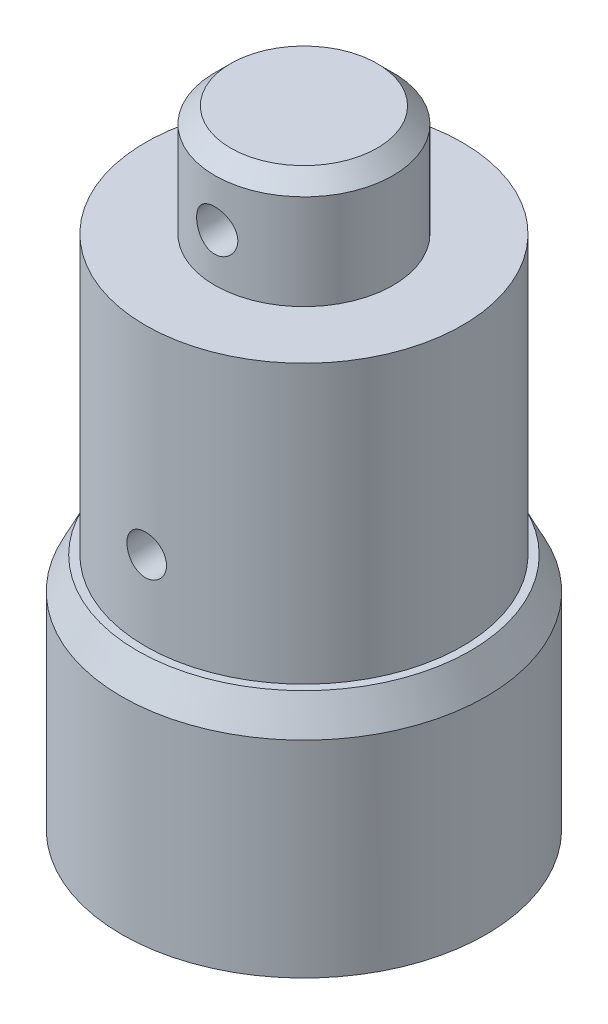
from build123d import *
from OCP.BRepFilletAPI import BRepFilletAPI_MakeChamfer

# Parameters (mm, degrees)
SKETCH1_R           = 12.7
BOSS_EXTRUDE1_DEPTH = 31.1658
SKETCH2_R           = 12.7
SKETCH2_R_2         = 3.2385
CUT_EXTRUDE1_DEPTH  = 12.7
CUT_EXTRUDE2_START  = -8.89
SKETCH3_R           = 12.7
SKETCH3_R_2         = 7.14375
CUT_EXTRUDE2_DEPTH  = 8.89
CHAMFER1_SIZE       = 1.27
SKETCH4_R           = 12.7
SKETCH4_R_2         = 7.747
BOSS_EXTRUDE2_DEPTH = 15.24
CHAMFER2_SIZE       = 2.54
SKETCH6_R           = 1.5875
SKETCH6_R_2         = 1.651
CUT_EXTRUDE3_DEPTH  = 50.8
SKETCH7_R           = 14.605
SKETCH7_R_2         = 10.795
BOSS_EXTRUDE3_DEPTH = 19.05
CHAMFER3_SIZE       = 1.27
CHAMFER3_SIZE2      = 2.54


with BuildPart() as part:
    # Sketch1 → Boss-Extrude1 (new body)
    with BuildSketch(Plane(origin=(0, 0, 0), x_dir=(1, 0, 0), z_dir=(0, 1, 0))):
        with Locations(Location((0, 0, 0), (0, 0, 270))):
            Circle(SKETCH1_R)
    extrude(amount=BOSS_EXTRUDE1_DEPTH)

    # Sketch2 → Cut-Extrude1 (cut)
    with BuildSketch(Plane.XZ):
        with Locations(Location((0, 0, 0), (0, 0, 270))):
            Circle(SKETCH2_R)
        with Locations(Location((0, 0, 0), (0, 0, 270))):
            Circle(SKETCH2_R_2, mode=Mode.SUBTRACT)
    extrude(amount=-CUT_EXTRUDE1_DEPTH, mode=Mode.SUBTRACT)

    # Sketch3 → Cut-Extrude2 (cut)
    with BuildSketch(Plane(origin=(0, 31.1658, 0), x_dir=(1, 0, 0), z_dir=(0, 1, 0)).offset(CUT_EXTRUDE2_START)):
        with Locations(Location((0, 0, 0), (0, 0, 90))):
            Circle(SKETCH3_R)
        with Locations(Location((0, 0, 0), (0, 0, 270))):
            Circle(SKETCH3_R_2, mode=Mode.SUBTRACT)
    extrude(amount=CUT_EXTRUDE2_DEPTH, mode=Mode.SUBTRACT)

    # Chamfer1
    chamfer1_edges = [part.edges().sort_by_distance(p)[0] for p in [
        (0, 31.1658, -7.14375),
        (0, 0, 3.2385),
    ]]
    chamfer(chamfer1_edges, length=CHAMFER1_SIZE)

    # Sketch4 → Boss-Extrude2 (add)
    with BuildSketch(Plane.XZ):
        with Locations(Location((0, 0, 0), (0, 0, 270))):
            Circle(SKETCH4_R)
        with Locations(Location((0, 0, 0), (0, 0, 270))):
            Circle(SKETCH4_R_2, mode=Mode.SUBTRACT)
    extrude(amount=-BOSS_EXTRUDE2_DEPTH)

    # Chamfer2
    chamfer2_edges = [part.edges().sort_by_distance(p)[0] for p in [
        (0, 0, 7.747),
    ]]
    chamfer(chamfer2_edges, length=CHAMFER2_SIZE)

    # Sketch6 → Cut-Extrude3 (cut, symmetric)
    with BuildSketch(Plane.XY):
        with Locations((0, 6.35)):
            Circle(SKETCH6_R)
        with Locations((0, 26.0858)):
            Circle(SKETCH6_R_2)
    extrude(amount=CUT_EXTRUDE3_DEPTH, both=True, mode=Mode.SUBTRACT)

    # Sketch7 → Boss-Extrude3 (add)
    with BuildSketch(Plane.XZ):
        with Locations(Location((0, 0, 0), (0, 0, 90))):
            Circle(SKETCH7_R)
        with Locations(Location((0, 0, 0), (0, 0, 90))):
            Circle(SKETCH7_R_2, mode=Mode.SUBTRACT)
    extrude(amount=BOSS_EXTRUDE3_DEPTH)

    # Chamfer3: one chamfer whose edges measure the first distance from different faces: ONE call of the kernel's chamfer builder (chamfer() names one face for all edges)
    chamfer3_edges_1 = [part.edges().sort_by_distance(p)[0] for p in [
        (0, 0, -14.605),
    ]]
    chamfer3_side_1 = [part.faces().sort_by_distance(p)[0] for p in [
        (0, 0, -14.191908218),
    ]]
    chamfer3_edges_2 = [part.edges().sort_by_distance(p)[0] for p in [
        (0, -19.05, -10.795),
    ]]
    chamfer3_side_2 = [part.faces().sort_by_distance(p)[0] for p in [
        (0, -19.05, -14.191908218),
    ]]
    chamfer3 = BRepFilletAPI_MakeChamfer(part.part.solid().wrapped)
    for e in chamfer3_edges_1:
        chamfer3.Add(CHAMFER3_SIZE, CHAMFER3_SIZE2, e.wrapped, chamfer3_side_1[0].wrapped)  # the first distance lies on this face
    for e in chamfer3_edges_2:
        chamfer3.Add(CHAMFER3_SIZE, CHAMFER3_SIZE2, e.wrapped, chamfer3_side_2[0].wrapped)  # the first distance lies on this face
    add(Compound.cast(chamfer3.Shape()), mode=Mode.REPLACE)


solid = part.part
